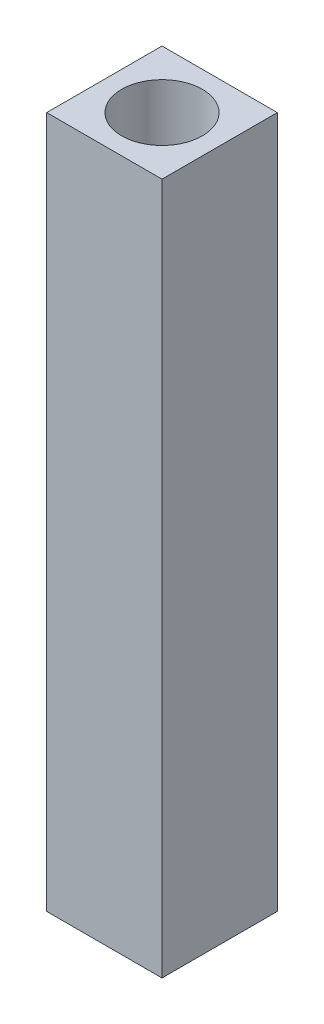
from build123d import *

# Parameters (mm, degrees)
SKETCH1_W           = 10
SKETCH1_H           = 10
SKETCH1_R           = 3.5
BOSS_EXTRUDE1_DEPTH = 60
SKETCH2_R           = 3.5
BOSS_EXTRUDE2_DEPTH = 40


with BuildPart() as part:
    # Sketch1 → Boss-Extrude1 (new body)
    with BuildSketch(Plane(origin=(0, 0, 0), x_dir=(1, 0, 0), z_dir=(0, 1, 0))):
        Rectangle(SKETCH1_W, SKETCH1_H)
        with Locations(Location((0, 0, 0), (0, 0, 270))):
            Circle(SKETCH1_R, mode=Mode.SUBTRACT)
    extrude(amount=BOSS_EXTRUDE1_DEPTH)

    # Sketch2 → Boss-Extrude2 (add)
    with BuildSketch(Plane(origin=(0, 0, 0), x_dir=(1, 0, 0), z_dir=(0, 1, 0))):
        with Locations(Location((0, 0, 0), (0, 0, 270))):
            Circle(SKETCH2_R)
    extrude(amount=BOSS_EXTRUDE2_DEPTH)


solid = part.part
